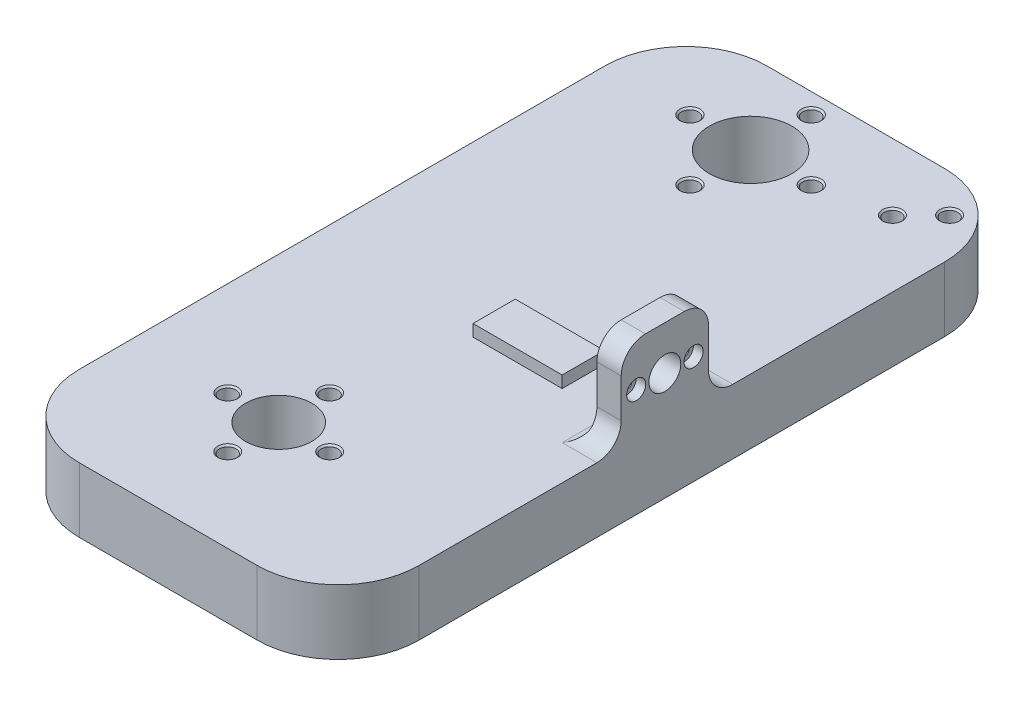
from build123d import *

# Parameters (mm, degrees)
SKETCH2_W                  = 53.34
SKETCH2_H                  = 107.950000118
SKETCH2_R                  = 5.207
SKETCH2_R_2                = 6.477
BOSS_EXTRUDE2_DEPTH        = 10.16
SKETCH14_R                 = 1.325
CUT_EXTRUDE5_DEPTH         = 93.555367213
CHAMFER2_SIZE              = 0.254
F_2_6_2_6_DIAMETER_HOLE1_D = 2.6
SKETCH5_W                  = 13.716
SKETCH5_H                  = 13.716
SKETCH5_R                  = 0.85
SKETCH5_R_2                = 2.5
BOSS_EXTRUDE3_DEPTH        = 3.81
SKETCH6_R                  = 1.5
CUT_EXTRUDE1_DEPTH         = 1.5
SKETCH7_W                  = 14.000233874
SKETCH7_H                  = 6.633249624
BOSS_EXTRUDE4_DEPTH        = 1.8542
FILLET1_R                  = 12.7
FILLET2_R                  = 3.81
FILLET3_R                  = 1.651
SKETCH13_R                 = 1.3
CUT_EXTRUDE4_DEPTH         = 94.012897289
CHAMFER3_SIZE              = 0.254
CHAMFER1_SIZE              = 0.254
SKETCH16_R                 = 1.325
CUT_EXTRUDE6_DEPTH         = 8.255
CHAMFER4_SIZE              = 0.254


with BuildPart() as part:
    # Sketch2 → Boss-Extrude2 (new body)
    with BuildSketch(Plane(origin=(0, 0, 0), x_dir=(1, 0, 0), z_dir=(0, 1, 0))):
        with Locations((3.81, 32.824999941)):
            Rectangle(SKETCH2_W, SKETCH2_H)
        with Locations(Location((0, 0, 0), (0, 0, 270))):
            Circle(SKETCH2_R, mode=Mode.SUBTRACT)
        with Locations(Location((0, 74.1, 0), (0, 0, 270))):
            Circle(SKETCH2_R_2, mode=Mode.SUBTRACT)
    extrude(amount=BOSS_EXTRUDE2_DEPTH)

    # Sketch14 → Cut-Extrude5 (cut, through all)
    with BuildSketch(Plane(origin=(0, 10.16, 0), x_dir=(1, 0, 0), z_dir=(0, 1, 0))):
        with Locations(Location((0, 83.625, 0), (0, 0, 270))):
            Circle(SKETCH14_R)
        with Locations(Location((-9.525, 74.1, 0), (0, 0, 270))):
            Circle(SKETCH14_R)
        with Locations(Location((9.525, 74.1, 0), (0, 0, 270))):
            Circle(SKETCH14_R)
        with Locations(Location((0, 64.575, 0), (0, 0, 270))):
            Circle(SKETCH14_R)
    extrude(amount=-CUT_EXTRUDE5_DEPTH, mode=Mode.SUBTRACT)

    # Chamfer2
    chamfer2_edges = [part.edges().sort_by_distance(p)[0] for p in [
        (0, 10.16, -84.95),
        (-9.525, 10.16, -75.425),
        (9.525, 10.16, -75.425),
        (0, 10.16, -65.9),
    ]]
    chamfer(chamfer2_edges, length=CHAMFER2_SIZE)

    # Ø2.6 (2.6) Diameter Hole1 (through all)
    with Locations(Plane(origin=(0, 10.16, 0), x_dir=(1, 0, 0), z_dir=(0, 1, 0))):
        with Locations((-8, 0), (0, 8), (8, 0), (0, -8)):
            Hole(F_2_6_2_6_DIAMETER_HOLE1_D / 2)

    # Sketch5 → Boss-Extrude3 (add)
    with BuildSketch(Plane(origin=(30.48, 0, 0), x_dir=(0, 0, -1), z_dir=(1, 0, 0))):
        with Locations((30.157999882, 17.018)):
            Rectangle(SKETCH5_W, SKETCH5_H)
        with Locations((25.657999882, 17.018)):
            Circle(SKETCH5_R, mode=Mode.SUBTRACT)
        with Locations((34.657999882, 17.018)):
            Circle(SKETCH5_R, mode=Mode.SUBTRACT)
        with Locations((30.157999882, 17.018)):
            Circle(SKETCH5_R_2, mode=Mode.SUBTRACT)
    extrude(amount=-BOSS_EXTRUDE3_DEPTH)

    # Sketch6 → Cut-Extrude1 (cut)
    with BuildSketch(Plane(origin=(30.48, 0, 0), x_dir=(0, 0, -1), z_dir=(1, 0, 0))):
        with Locations((25.657999882, 17.018)):
            Circle(SKETCH6_R)
        with Locations((34.657999882, 17.018)):
            Circle(SKETCH6_R)
    extrude(amount=-CUT_EXTRUDE1_DEPTH, mode=Mode.SUBTRACT)

    # Sketch7 → Boss-Extrude4 (add)
    with BuildSketch(Plane(origin=(0, 10.16, 0), x_dir=(1, 0, 0), z_dir=(0, 1, 0))):
        with Locations((10.669883029, 30.157999882)):
            Rectangle(SKETCH7_W, SKETCH7_H)
    extrude(amount=BOSS_EXTRUDE4_DEPTH)

    # Fillet1
    fillet1_edges = [part.edges().sort_by_distance(p)[0] for p in [
        (-22.86, 5.08, -86.8),
        (30.48, 5.08, -86.8),
        (30.48, 5.08, 21.150000118),
        (-22.86, 5.08, 21.150000118),
    ]]
    fillet(fillet1_edges, radius=FILLET1_R)

    # Fillet2
    fillet2_edges = [part.edges().sort_by_distance(p)[0] for p in [
        (28.575, 10.16, -23.299999882),
        (28.575, 23.876, -23.299999882),
        (28.575, 23.876, -37.015999882),
        (28.575, 10.16, -37.015999882),
    ]]
    fillet(fillet2_edges, radius=FILLET2_R)

    # Fillet3
    fillet3_edges = [part.edges().sort_by_distance(p)[0] for p in [
        (26.67, 10.16, -30.157999882),
    ]]
    fillet(fillet3_edges, radius=FILLET3_R)

    # Sketch13 → Cut-Extrude4 (cut, through all)
    with BuildSketch(Plane(origin=(0, 10.16, 0), x_dir=(1, 0, 0), z_dir=(0, 1, 0))):
        with Locations(Location((24.515192091, 80.835192091, 0), (0, 0, 270))):
            Circle(SKETCH13_R)
        with Locations(Location((20.02506403, 76.34506403, 0), (0, 0, 270))):
            Circle(SKETCH13_R)
    extrude(amount=-CUT_EXTRUDE4_DEPTH, mode=Mode.SUBTRACT)

    # Chamfer3
    chamfer3_edges = [part.edges().sort_by_distance(p)[0] for p in [
        (24.515192091, 10.16, -82.135192091),
        (20.02506403, 10.16, -77.64506403),
    ]]
    chamfer(chamfer3_edges, length=CHAMFER3_SIZE)

    # Chamfer1
    chamfer1_edges = [part.edges().sort_by_distance(p)[0] for p in [
        (-6.7, 10.16, 0),
        (1.3, 10.16, 8),
        (9.3, 10.16, 0),
        (1.3, 10.16, -8),
    ]]
    chamfer(chamfer1_edges, length=CHAMFER1_SIZE)

    # Sketch16 → Cut-Extrude6 (cut)
    with BuildSketch(Plane.XZ):
        with Locations(Location((15.24, -30.157999882, 0), (0, 0, 270))):
            Circle(SKETCH16_R)
        with Locations(Location((7.62, -30.157999882, 0), (0, 0, 270))):
            Circle(SKETCH16_R)
    extrude(amount=-CUT_EXTRUDE6_DEPTH, mode=Mode.SUBTRACT)

    # Chamfer4
    chamfer4_edges = [part.edges().sort_by_distance(p)[0] for p in [
        (15.24, 0, -28.832999882),
        (7.62, 0, -28.832999882),
    ]]
    chamfer(chamfer4_edges, length=CHAMFER4_SIZE)


solid = part.part
